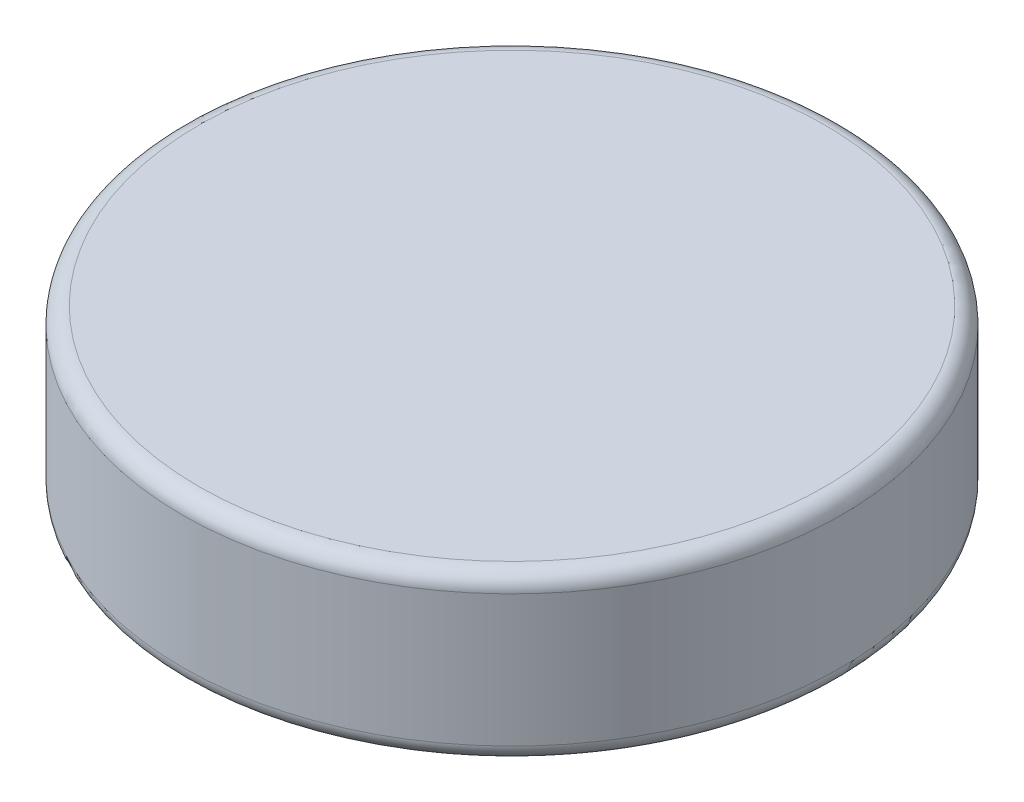
from build123d import *

# Parameters (mm, degrees)
SKETCH1_R           = 6.35
BOSS_EXTRUDE1_DEPTH = 1.5875
FILLET1_R           = 0.3175


with BuildPart() as part:
    # Sketch1 → Boss-Extrude1 (new, symmetric)
    with BuildSketch(Plane(origin=(0, 0, 0), x_dir=(1, 0, 0), z_dir=(0, 1, 0))):
        with Locations(Location((0, 0, 0), (0, 0, 270))):
            Circle(SKETCH1_R)
    extrude(amount=BOSS_EXTRUDE1_DEPTH, both=True)

    # Fillet1
    fillet1_edges = [part.edges().sort_by_distance(p)[0] for p in [
        (0, -1.5875, -6.35),
        (0, 1.5875, -6.35),
    ]]
    fillet(fillet1_edges, radius=FILLET1_R)


solid = part.part
